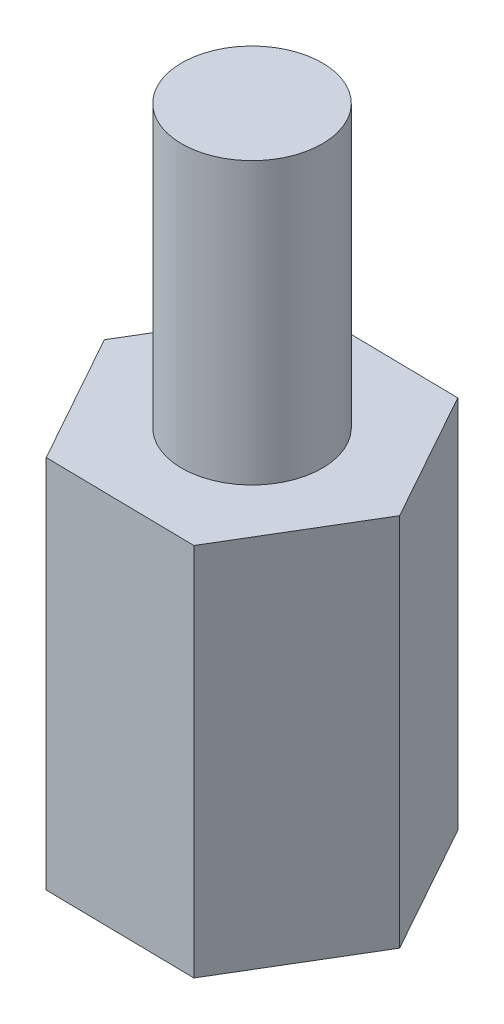
from build123d import *

# Parameters (mm, degrees)
SKETCH_1_R      = 1.5
EXTRUDE_1_DEPTH = 8
SKETCH_2_R      = 1.5
EXTRUDE_2_DEPTH = 6


with BuildPart() as part:
    # 草图1 → 凸台-拉伸1 (new body)
    with BuildSketch(Plane(origin=(0, 0, 0), x_dir=(1, 0, 0), z_dir=(0, 1, 0))):
        Polygon((-2.218717439, -2.350783953), (-0.573203199, 0.398721982), (-2.131588067, 3.198532083), (-5.335487174, 3.24883625), (-6.981001414, 0.499330315), (-5.422616546, -2.300479787), align=None)
        with Locations(Location((-3.777102307, 0.449026148, 0), (0, 0, 270))):
            Circle(SKETCH_1_R, mode=Mode.SUBTRACT)
    extrude(amount=EXTRUDE_1_DEPTH)


with BuildPart() as body_2:
    # 草图2 → 凸台-拉伸2 (new body)
    with BuildSketch(Plane(origin=(0, 8, 0), x_dir=(1, 0, 0), z_dir=(0, 1, 0))):
        with Locations(Location((-3.777102307, 0.449026148, 0), (0, 0, 270))):
            Circle(SKETCH_2_R)
    extrude(amount=EXTRUDE_2_DEPTH)


solid = Compound([part.part, body_2.part])
